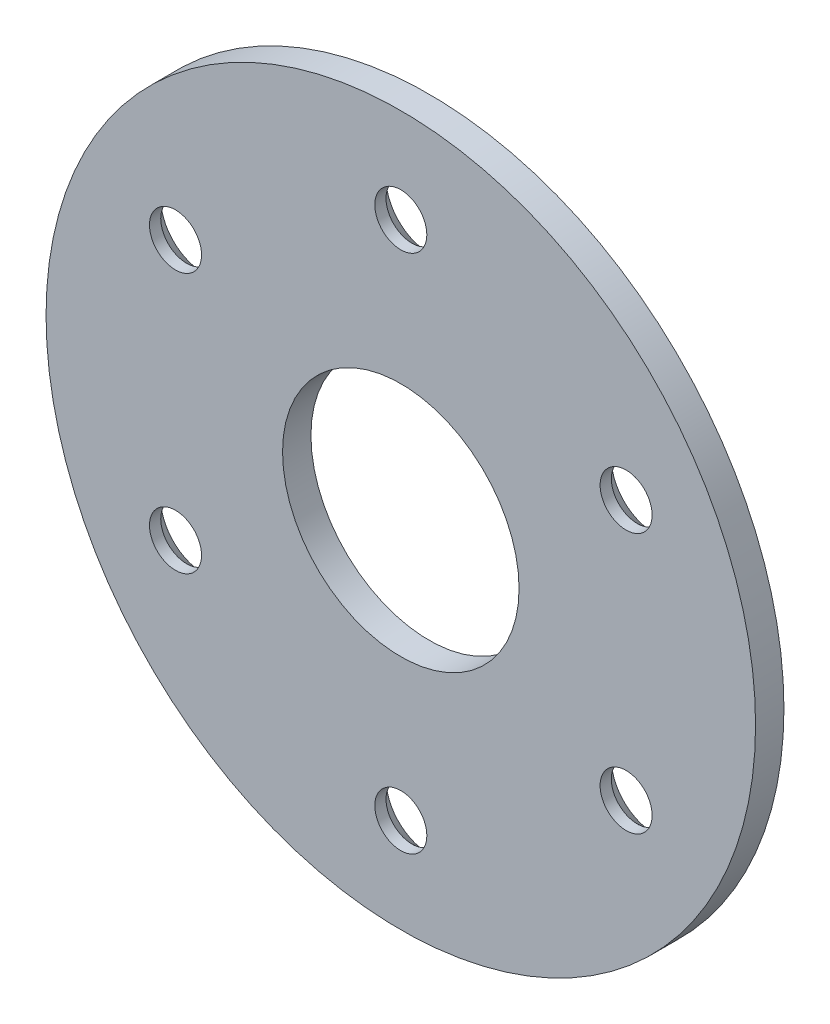
from build123d import *

# Parameters (mm, degrees)
SKETCH_1_R                  = 75
SKETCH_1_R_2                = 25
SKETCH_1_R_3                = 5.5
EXTRUDE_1_DEPTH             = 3
HOLE_WIZARD_M81_D           = 9
HOLE_WIZARD_M81_DEPTH       = 17
HOLE_WIZARD_M81_CSINK_D     = 18.25
HOLE_WIZARD_M81_CSINK_ANGLE = 90
HOLE_WIZARD_M81_TIP         = 2.703872786


with BuildPart() as part:
    # Эскиз1 → Бобышка-Вытянуть1 (new, symmetric)
    with BuildSketch(Plane.XY):
        Circle(SKETCH_1_R)
        Circle(SKETCH_1_R_2, mode=Mode.SUBTRACT)
        with Locations((0, 55)):
            Circle(SKETCH_1_R_3, mode=Mode.SUBTRACT)
        with Locations((47.631397208, 27.5)):
            Circle(SKETCH_1_R_3, mode=Mode.SUBTRACT)
        with Locations((47.631397208, -27.5)):
            Circle(SKETCH_1_R_3, mode=Mode.SUBTRACT)
        with Locations((0, -55)):
            Circle(SKETCH_1_R_3, mode=Mode.SUBTRACT)
        with Locations((-47.631397208, -27.5)):
            Circle(SKETCH_1_R_3, mode=Mode.SUBTRACT)
        with Locations((-47.631397208, 27.5)):
            Circle(SKETCH_1_R_3, mode=Mode.SUBTRACT)
    extrude(amount=EXTRUDE_1_DEPTH, both=True)

    # Зенковка для винта с потайной головкой и внутренним шестигранником M81
    with Locations(Plane(origin=(0, 0, -3), x_dir=(-1, 0, 0), z_dir=(0, 0, -1))):
        with Locations((0, 55), (47.631397208, 27.5), (47.631397208, -27.5), (0, -55), (-47.631397208, -27.5), (-47.631397208, 27.5)):
            CounterSinkHole(HOLE_WIZARD_M81_D / 2, HOLE_WIZARD_M81_CSINK_D / 2, depth=HOLE_WIZARD_M81_DEPTH, counter_sink_angle=HOLE_WIZARD_M81_CSINK_ANGLE)
            with Locations((0, 0, -(HOLE_WIZARD_M81_DEPTH + HOLE_WIZARD_M81_TIP / 2))):  # 118° drill point
                Cone(0, HOLE_WIZARD_M81_D / 2, HOLE_WIZARD_M81_TIP, mode=Mode.SUBTRACT)


solid = part.part
